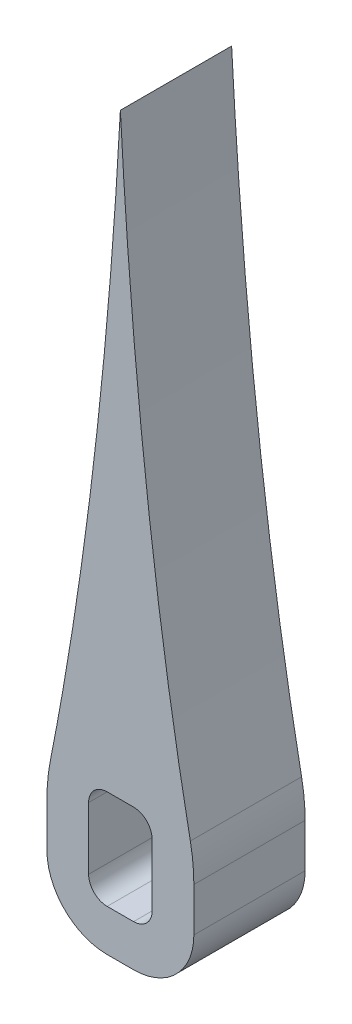
from build123d import *

# Parameters (mm, degrees)
BOSS_EXTRUDE2_DEPTH = 6.096


with BuildPart() as part:
    # Sketch1 → Boss-Extrude2 (new body)
    with BuildSketch(Plane.XY):
        with BuildLine():
            Line((-4.0259, 0.692415095), (-4.0259, -1.7018))
            ThreePointArc((-4.0259, -1.7018), (-3.058766591, -4.036666591), (-0.7239, -5.0038))
            Line((-0.7239, -5.0038), (0.7239, -5.0038))
            ThreePointArc((0.7239, -5.0038), (3.058766591, -4.036666591), (4.0259, -1.7018))
            Line((4.0259, -1.7018), (4.0259, 0.692415095))
            ThreePointArc((4.0259, 0.692415095), (3.977581548, 1.682110135), (3.833085773, 2.662391684))
            add(Edge.make_bspline(
                [(3.833085773, 2.662391684), (2.882993145, 7.469428366), (1.294052888, 17.736271143), (0.32760263, 29.308652747), (0, 35.421228256)],
                knots=[0.032373922, 0.032373922, 0.032373922, 0.032373922, 0.516186961, 1, 1, 1, 1], degree=3))
            add(Edge.make_bspline(
                [(-3.833085773, 2.662391684), (-2.882993145, 7.469428366), (-1.294052888, 17.736271143), (-0.32760263, 29.308652747), (0, 35.421228256)],
                knots=[0.032373922, 0.032373922, 0.032373922, 0.032373922, 0.516186961, 1, 1, 1, 1], degree=3))
            ThreePointArc((-3.833085773, 2.662391684), (-3.977581548, 1.682110135), (-4.0259, 0.692415095))
        make_face()
        with BuildLine():
            Line((-1.7399, 1.7018), (-1.7399, -1.7018))
            ThreePointArc((-1.7399, -1.7018), (-1.44232049, -2.42022049), (-0.7239, -2.7178))
            Line((-0.7239, -2.7178), (0.7239, -2.7178))
            ThreePointArc((0.7239, -2.7178), (1.44232049, -2.42022049), (1.7399, -1.7018))
            Line((1.7399, -1.7018), (1.7399, 1.7018))
            ThreePointArc((1.7399, 1.7018), (1.44232049, 2.42022049), (0.7239, 2.7178))
            Line((0.7239, 2.7178), (-0.7239, 2.7178))
            ThreePointArc((-0.7239, 2.7178), (-1.44232049, 2.42022049), (-1.7399, 1.7018))
        make_face(mode=Mode.SUBTRACT)
    extrude(amount=BOSS_EXTRUDE2_DEPTH)


solid = part.part
